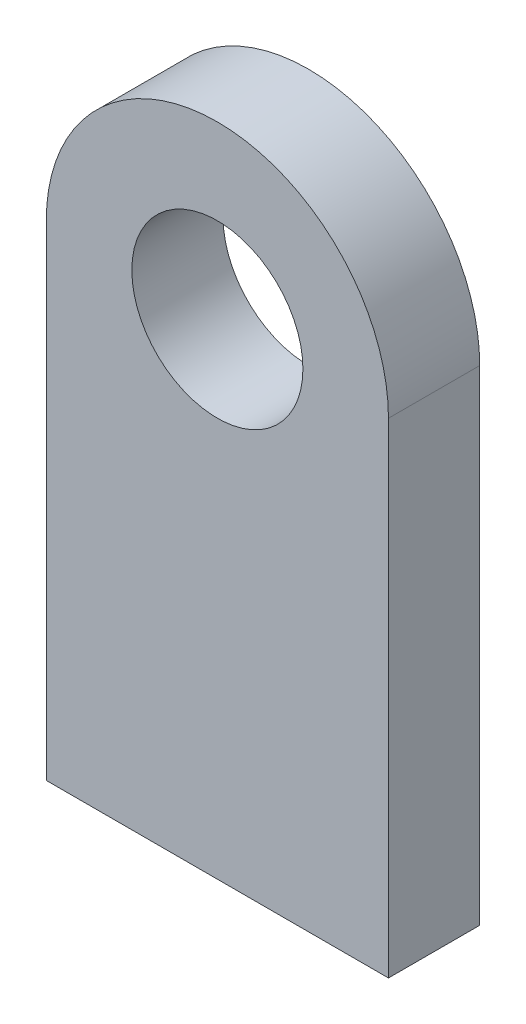
from build123d import *

# Parameters (mm, degrees)
SKETCH_1_R      = 15
EXTRUDE_1_DEPTH = 16


with BuildPart() as part:
    # 草图1 → 凸台-拉伸1 (new body)
    with BuildSketch(Plane.XY):
        with BuildLine():
            Line((30, 0), (30, -85))
            Line((30, -85), (-30, -85))
            Line((-30, -85), (-30, 0))
            ThreePointArc((-30, 0), (0, 30), (30, 0))
        make_face()
        Circle(SKETCH_1_R, mode=Mode.SUBTRACT)
    extrude(amount=EXTRUDE_1_DEPTH)


solid = part.part
